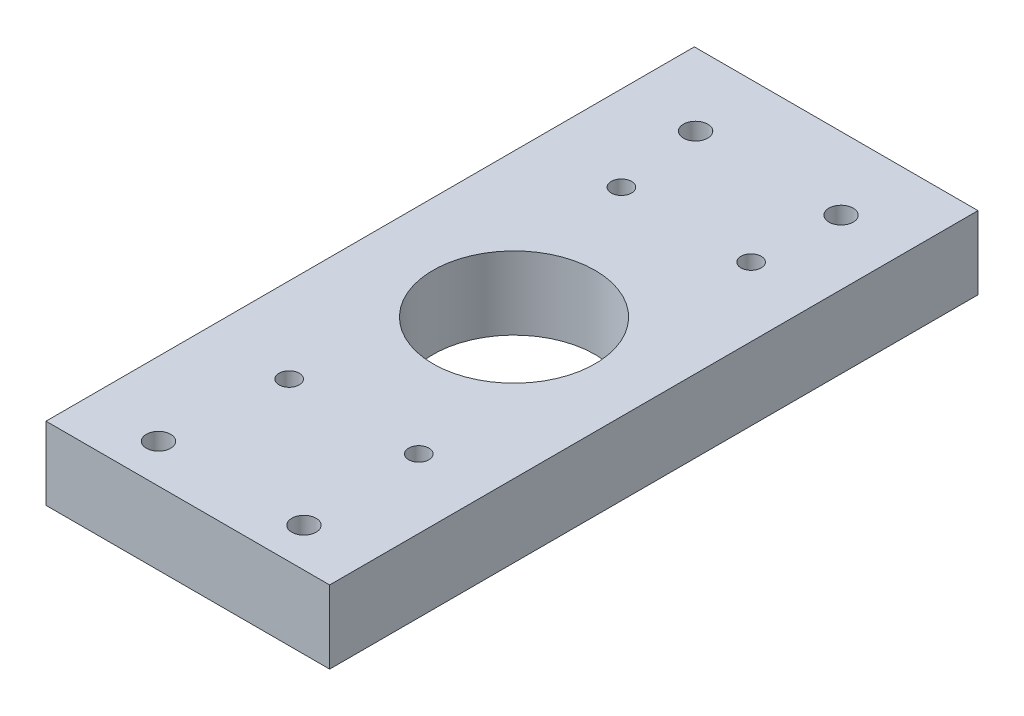
from build123d import *

# Parameters (mm, degrees)
SKETCH1_W                    = 70
SKETCH1_H                    = 160
BOSS_EXTRUDE1_DEPTH          = 18
SKETCH2_R                    = 20
CUT_EXTRUDE1_DEPTH           = 90.157164603
F_6_0_6_DIAMETER_HOLE1_D     = 6
F_4_0_4_DIAMETER_HOLE1_D     = 4
F_4_0_4_DIAMETER_HOLE1_DEPTH = 30
F_5_0_5_DIAMETER_HOLE1_D     = 5


with BuildPart() as part:
    # Sketch1 → Boss-Extrude1 (new body)
    with BuildSketch(Plane(origin=(0, 0, 0), x_dir=(1, 0, 0), z_dir=(0, 1, 0))):
        Rectangle(SKETCH1_W, SKETCH1_H)
    extrude(amount=BOSS_EXTRUDE1_DEPTH)

    # Sketch2 → Cut-Extrude1 (cut, through all)
    with BuildSketch(Plane(origin=(0, 18, 0), x_dir=(1, 0, 0), z_dir=(0, 1, 0))):
        with Locations(Location((0.500000036, 0.001841312, 0), (0, 0, 270))):
            Circle(SKETCH2_R)
    extrude(amount=-CUT_EXTRUDE1_DEPTH, mode=Mode.SUBTRACT)

    # Ø6.0 (6) Diameter Hole1 (through all)
    with Locations(Plane(origin=(0, 18, 0), x_dir=(1, 0, 0), z_dir=(0, 1, 0))):
        with Locations((19.069096126, 62.135567862), (-16.824568918, 62.135567862), (19.069096126, -70.412962857), (-16.824568918, -70.412962857)):
            Hole(F_6_0_6_DIAMETER_HOLE1_D / 2)

    # Ø4.0 (4) Diameter Hole1
    with Locations(Plane.ZY.offset(35)):
        with Locations((28, 9), (-28, 9)):
            Hole(F_4_0_4_DIAMETER_HOLE1_D / 2, depth=F_4_0_4_DIAMETER_HOLE1_DEPTH)

    # Ø5.0 (5) Diameter Hole1 (through all)
    with Locations(Plane(origin=(0, 18, 0), x_dir=(1, 0, 0), z_dir=(0, 1, 0))):
        with Locations((18, 41), (-14, 41), (18, -41), (-14, -41)):
            Hole(F_5_0_5_DIAMETER_HOLE1_D / 2)


solid = part.part
